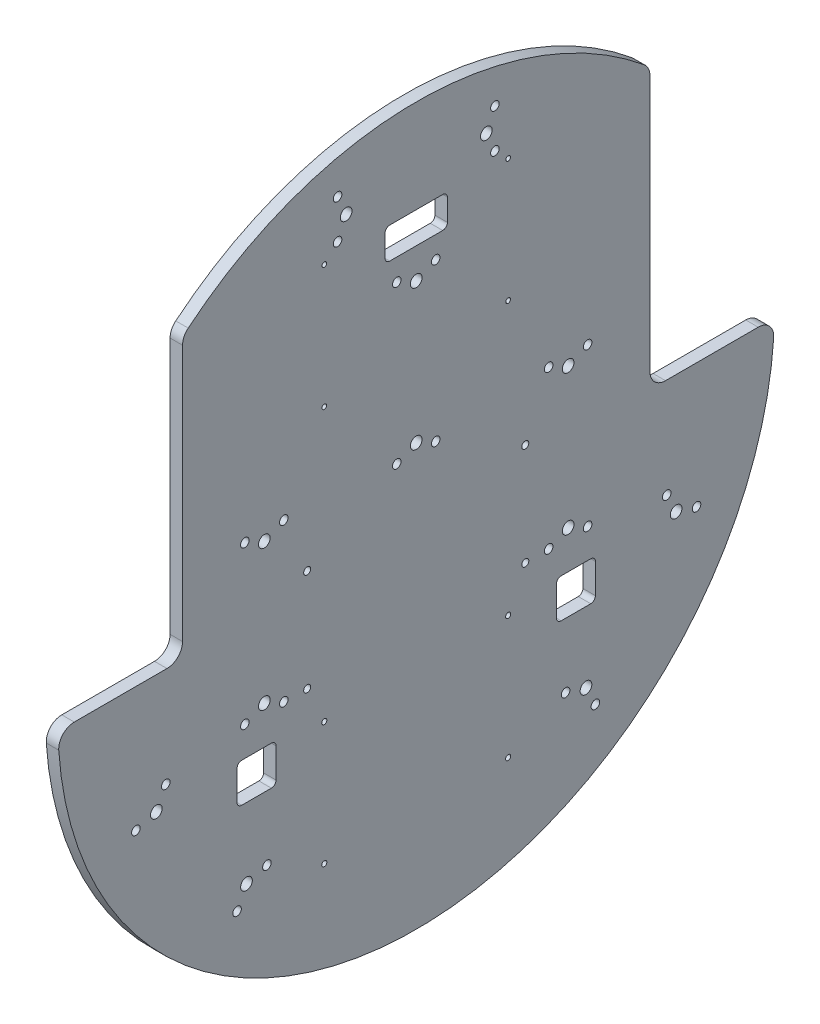
from build123d import *

# Parameters (mm, degrees)
SKETCH_1_R          = 230
EXTRUDE_1_DEPTH     = 8
SKETCH_3_W          = 80
SKETCH_3_H          = 200
CUT_EXTRUDE_1_DEPTH = 10
SKETCH_4_R          = 3.75
SKETCH_4_R_2        = 2.75
CUT_EXTRUDE_2_DEPTH = 10
SKETCH_6_W          = 40
SKETCH_6_H          = 20
SKETCH_6_W_2        = 25
SKETCH_6_H_2        = 25
CUT_EXTRUDE_4_DEPTH = 10
FILLET_2_R          = 10
FILLET_3_R          = 10
FILLET_4_R          = 10
SKETCH_7_R          = 2.75
SKETCH_7_R_2        = 3.75
CUT_EXTRUDE_5_DEPTH = 10
SKETCH_8_R          = 1.5
CUT_EXTRUDE_6_DEPTH = 326.005785815
SKETCH_9_R          = 2.25
CUT_EXTRUDE_7_DEPTH = 11
FILLET_5_R          = 3
SKETCH_10_R         = 1.65
CUT_EXTRUDE_8_DEPTH = 10


with BuildPart() as part:
    # 草图1 → 凸台-拉伸1 (new body)
    with BuildSketch(Plane(origin=(0, 0, 0), x_dir=(0, 0, -1), z_dir=(1, 0, 0))):
        Circle(SKETCH_1_R)
    extrude(amount=EXTRUDE_1_DEPTH)

    # 草图3 → 切除-拉伸1 (cut)
    with BuildSketch(Plane(origin=(8, 0, 0), x_dir=(0, 0, -1), z_dir=(1, 0, 0))):
        with Locations((190, 95)):
            Rectangle(SKETCH_3_W, SKETCH_3_H)
        with Locations((-190, 95)):
            Rectangle(SKETCH_3_W, SKETCH_3_H)
    extrude(amount=-CUT_EXTRUDE_1_DEPTH, mode=Mode.SUBTRACT)

    # 草图4 → 切除-拉伸2 (cut)
    with BuildSketch(Plane(origin=(8, 0, 0), x_dir=(0, 0, -1), z_dir=(1, 0, 0))):
        with Locations((166.813442197, -81.229769803)):
            Circle(SKETCH_4_R)
        with Locations((108.962557326, -150.173769684)):
            Circle(SKETCH_4_R)
        with Locations((-108.962557326, -150.173769684)):
            Circle(SKETCH_4_R)
        with Locations((-166.813442197, -81.229769803)):
            Circle(SKETCH_4_R)
        with Locations((-45, 190)):
            Circle(SKETCH_4_R)
        with Locations((45, 190)):
            Circle(SKETCH_4_R)
        with Locations((-12.5, 35)):
            Circle(SKETCH_4_R_2)
        with Locations((12.5, 35)):
            Circle(SKETCH_4_R_2)
        with Locations((-50.5, 202.5)):
            Circle(SKETCH_4_R_2)
        with Locations((50.5, 202.5)):
            Circle(SKETCH_4_R_2)
        with Locations((-50.5, 177.5)):
            Circle(SKETCH_4_R_2)
        with Locations((50.5, 177.5)):
            Circle(SKETCH_4_R_2)
        with Locations((179.92432959, -85.051370487)):
            Circle(SKETCH_4_R_2)
        with Locations((115.002781011, -162.421859242)):
            Circle(SKETCH_4_R_2)
        with Locations((160.773218512, -68.981680245)):
            Circle(SKETCH_4_R_2)
        with Locations((95.851669933, -146.352169)):
            Circle(SKETCH_4_R_2)
        with Locations((-160.773218512, -68.981680245)):
            Circle(SKETCH_4_R_2)
        with Locations((-179.92432959, -85.051370487)):
            Circle(SKETCH_4_R_2)
        with Locations((-95.851669933, -146.352169)):
            Circle(SKETCH_4_R_2)
        with Locations((-115.002781011, -162.421859242)):
            Circle(SKETCH_4_R_2)
        with Locations((12.5, 136)):
            Circle(SKETCH_4_R_2)
        with Locations((-12.5, 136)):
            Circle(SKETCH_4_R_2)
        with Locations((0, 130.5)):
            Circle(SKETCH_4_R)
        with Locations((0, 40.5)):
            Circle(SKETCH_4_R)
    extrude(amount=-CUT_EXTRUDE_2_DEPTH, mode=Mode.SUBTRACT)

    # 草图6 → 切除-拉伸4 (cut)
    with BuildSketch(Plane(origin=(8, 0, 0), x_dir=(0, 0, -1), z_dir=(1, 0, 0))):
        with Locations((0, 160)):
            Rectangle(SKETCH_6_W, SKETCH_6_H)
        with Locations((-102.5, -92.5)):
            Rectangle(SKETCH_6_W_2, SKETCH_6_H_2)
        with Locations((102.5, -92.5)):
            Rectangle(SKETCH_6_W_2, SKETCH_6_H_2)
    extrude(amount=-CUT_EXTRUDE_4_DEPTH, mode=Mode.SUBTRACT)

    # 圆角2
    fillet_2_edges = [part.edges().sort_by_distance(p)[0] for p in [
        (4, -5, 229.945645751),
    ]]
    fillet(fillet_2_edges, radius=FILLET_2_R)

    # 圆角3
    fillet_3_edges = [part.edges().sort_by_distance(p)[0] for p in [
        (4, 174.355957742, -150),
        (4, -5, -229.945645751),
        (4, 174.355957742, 150),
    ]]
    fillet(fillet_3_edges, radius=FILLET_3_R)

    # 圆角4
    fillet_4_edges = [part.edges().sort_by_distance(p)[0] for p in [
        (4, -5, -150),
        (4, -5, 150),
    ]]
    fillet(fillet_4_edges, radius=FILLET_4_R)

    # 草图7 → 切除-拉伸5 (cut)
    with BuildSketch(Plane(origin=(8, 0, 0), x_dir=(0, 0, -1), z_dir=(1, 0, 0))):
        with Locations((85, 40)):
            Circle(SKETCH_7_R)
        with Locations((110, 40)):
            Circle(SKETCH_7_R)
        with Locations((85, -61)):
            Circle(SKETCH_7_R)
        with Locations((110, -61)):
            Circle(SKETCH_7_R)
        with Locations((97.5, 34.5)):
            Circle(SKETCH_7_R_2)
        with Locations((97.5, -55.5)):
            Circle(SKETCH_7_R_2)
        with Locations((-97.5, -55.5)):
            Circle(SKETCH_7_R_2)
        with Locations((-97.5, 34.5)):
            Circle(SKETCH_7_R_2)
        with Locations((-110, -61)):
            Circle(SKETCH_7_R)
        with Locations((-85, -61)):
            Circle(SKETCH_7_R)
        with Locations((-110, 40)):
            Circle(SKETCH_7_R)
        with Locations((-85, 40)):
            Circle(SKETCH_7_R)
    extrude(amount=-CUT_EXTRUDE_5_DEPTH, mode=Mode.SUBTRACT)

    # 草图8 → 切除-拉伸6 (cut, through all)
    with BuildSketch(Plane(origin=(8, 0, 0), x_dir=(0, 0, -1), z_dir=(1, 0, 0))):
        with Locations((-59, 169)):
            Circle(SKETCH_8_R)
        with Locations((-59, 90)):
            Circle(SKETCH_8_R)
        with Locations((59, 169)):
            Circle(SKETCH_8_R)
        with Locations((59, 90)):
            Circle(SKETCH_8_R)
    extrude(amount=-CUT_EXTRUDE_6_DEPTH, mode=Mode.SUBTRACT)

    # 草图9 → 切除-拉伸7 (cut)
    with BuildSketch(Plane(origin=(8, 0, 0), x_dir=(0, 0, -1), z_dir=(1, 0, 0))):
        with Locations((70, 4.25)):
            Circle(SKETCH_9_R)
        with Locations((70, -61.25)):
            Circle(SKETCH_9_R)
        with Locations((-70, 4.25)):
            Circle(SKETCH_9_R)
        with Locations((-70, -61.25)):
            Circle(SKETCH_9_R)
    extrude(amount=-CUT_EXTRUDE_7_DEPTH, mode=Mode.SUBTRACT)

    # 圆角5
    fillet_5_edges = [part.edges().sort_by_distance(p)[0] for p in [
        (4, -105, 115),
        (4, -80, 115),
        (4, -80, 90),
        (4, -105, 90),
        (4, 150, 20),
        (4, 170, 20),
        (4, 170, -20),
        (4, 150, -20),
        (4, -105, -90),
        (4, -80, -90),
        (4, -80, -115),
        (4, -105, -115),
    ]]
    fillet(fillet_5_edges, radius=FILLET_5_R)

    # 草图10 → 切除-拉伸8 (cut)
    with BuildSketch(Plane(origin=(8, 0, 0), x_dir=(0, 0, -1), z_dir=(1, 0, 0))):
        with Locations((-59, -85)):
            Circle(SKETCH_10_R)
        with Locations((59, -85)):
            Circle(SKETCH_10_R)
        with Locations((59, -164)):
            Circle(SKETCH_10_R)
        with Locations((-59, -164)):
            Circle(SKETCH_10_R)
    extrude(amount=-CUT_EXTRUDE_8_DEPTH, mode=Mode.SUBTRACT)


solid = part.part
